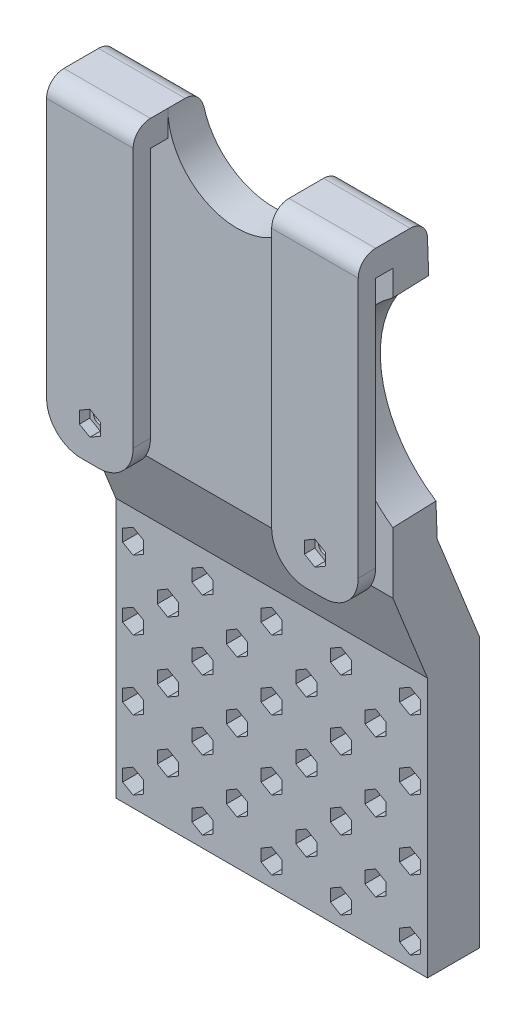
from build123d import *

# Parameters (mm, degrees)
EXTRUDE_1_DEPTH        = 45
EXTRUDE_1_DEPTH_BACK   = 45
CUT_EXTRUDE_1_REACH    = 117.109
SKETCH_2_W             = 40
SKETCH_2_H             = 90
CUT_EXTRUDE_2_DEPTH    = 113.472218792
CUT_EXTRUDE_3_REACH    = 114.571
FILLET_1_R             = 10
SKETCH_6_R             = 2
CUT_EXTRUDE_4_DEPTH    = 116.108644371
CUT_EXTRUDE_5_DEPTH    = 3
CUT_EXTRUDE_6_DEPTH    = 22
SKETCH_9_R             = 2
CUT_EXTRUDE_7_DEPTH    = 116.108644371
PATTERN_LINEAR_1_COUNT = 24
PATTERN_LINEAR_1_PITCH = 20
CUT_EXTRUDE_8_DEPTH    = 12
PATTERN_LINEAR_2_COUNT = 5
PATTERN_LINEAR_2_PITCH = 20


with BuildPart() as part:
    # 草图1 → 凸台-拉伸1 (new, two sides: drawn at the far end of the back side and taken through both)
    with BuildSketch(Plane(origin=(0, 0, 0), x_dir=(0, 0, -1), z_dir=(1, 0, 0)).offset(-EXTRUDE_1_DEPTH_BACK)):
        with BuildLine():
            Line((-2.5, 0), (-2.5, 82.5))
            Line((-2.5, 82.5), (2.5, 82.5))
            Line((2.5, 82.5), (2.5, 0))
            Line((2.5, 0), (12.5, -25))
            Line((12.5, -25), (12.5, -100))
            Line((12.5, -100), (27.5, -100))
            Line((27.5, -100), (27.5, -22.111263946))
            Line((27.5, -22.111263946), (15.30380141, 8.379232528))
            Line((15.30380141, 8.379232528), (12.5, 85.182410093))
            ThreePointArc((12.5, 85.182410093), (10.973771474, 88.599447906), (7.503328452, 90))
            Line((7.503328452, 90), (-2.5, 90))
            ThreePointArc((-2.5, 90), (-6.035533906, 88.535533906), (-7.5, 85))
            Line((-7.5, 85), (-7.5, 0))
            Line((-7.5, 0), (-2.5, 0))
        make_face()
    extrude(amount=EXTRUDE_1_DEPTH + EXTRUDE_1_DEPTH_BACK)

    # 切除-拉伸1: up to this face of the body (flat: up to its plane)
    cut_extrude_1_end = Plane(part.part.faces().sort_by_distance((0, 41.25, -2.5))[0])
    # 草图2 → 切除-拉伸1 (cut, up to the picked face)
    with BuildSketch(Plane.XY.offset(7.5), mode=Mode.PRIVATE) as cut_extrude_1_sk1:
        with Locations((0, 45)):
            Rectangle(SKETCH_2_W, SKETCH_2_H)
    cut_extrude_1_tool1 = split(extrude(cut_extrude_1_sk1.sketch, amount=-CUT_EXTRUDE_1_REACH, mode=Mode.PRIVATE), bisect_by=cut_extrude_1_end, keep=Keep.BOTH, mode=Mode.PRIVATE)
    add(cut_extrude_1_tool1.solids().sort_by(Axis((0, 45, 7.5), (0, 0, -1)))[0], mode=Mode.SUBTRACT)

    # 草图3 → 切除-拉伸2 (cut, through all)
    with BuildSketch(Plane.XY.offset(-2.5)):
        with BuildLine():
            Line((20, 90), (-20, 90))
            ThreePointArc((-20, 90), (0, 70), (20, 90))
        make_face()
    extrude(amount=-CUT_EXTRUDE_2_DEPTH, mode=Mode.SUBTRACT)

    # 切除-拉伸3: up to this plane
    cut_extrude_3_end = Plane(origin=(-45, 82.5, -2.5), z_dir=(0, 0, 1))
    # 草图4 → 切除-拉伸3 (cut, up to the surface)
    with BuildSketch(Plane(origin=(0, 0.569094139, -15.588920825), x_dir=(-1, 0, 0), z_dir=(0, 0.036482018521591525, -0.9993343095904346)), mode=Mode.PRIVATE) as cut_extrude_3_sk1:
        with BuildLine():
            Line((-45, 74.9653236), (-45, 17.519697135))
            ThreePointArc((-45, 17.519697135), (-30, 46.242510367), (-45, 74.9653236))
        make_face()
    cut_extrude_3_tool1 = split(extrude(cut_extrude_3_sk1.sketch, amount=-CUT_EXTRUDE_3_REACH, mode=Mode.PRIVATE), bisect_by=cut_extrude_3_end, keep=Keep.BOTH, mode=Mode.PRIVATE)
    add(cut_extrude_3_tool1.solids().sort_by_distance((38.874032, 46.780821, -13.901901))[0], mode=Mode.SUBTRACT)
    # 草图4 → 切除-拉伸3 (cut, up to the surface)
    with BuildSketch(Plane(origin=(0, 0.569094139, -15.588920825), x_dir=(-1, 0, 0), z_dir=(0, 0.036482018521591525, -0.9993343095904346)), mode=Mode.PRIVATE) as cut_extrude_3_sk2:
        with BuildLine():
            Line((45, 74.9653236), (45, 17.519697135))
            ThreePointArc((45, 17.519697135), (30, 46.242510367), (45, 74.9653236))
        make_face()
    cut_extrude_3_tool2 = split(extrude(cut_extrude_3_sk2.sketch, amount=-CUT_EXTRUDE_3_REACH, mode=Mode.PRIVATE), bisect_by=cut_extrude_3_end, keep=Keep.BOTH, mode=Mode.PRIVATE)
    add(cut_extrude_3_tool2.solids().sort_by_distance((-38.874032, 46.780821, -13.901901))[0], mode=Mode.SUBTRACT)

    # 圆角1
    fillet_1_edges = [part.edges().sort_by_distance(p)[0] for p in [
        (45, 0, 5),
        (-45, 0, 5),
        (-20, 0, 5),
        (20, 0, 5),
    ]]
    fillet(fillet_1_edges, radius=FILLET_1_R)

    # 草图6 → 切除-拉伸4 (cut, through all)
    with BuildSketch(Plane.XY.offset(7.5)):
        with Locations(Location((-32.5, 10, 0), (0, 0, 305.866559589))):
            Circle(SKETCH_6_R)
        with Locations(Location((32.5, 10, 0), (0, 0, 90))):
            Circle(SKETCH_6_R)
    extrude(amount=-CUT_EXTRUDE_4_DEPTH, mode=Mode.SUBTRACT)

    # 草图7 → 切除-拉伸5 (cut)
    with BuildSketch(Plane.XY.offset(7.5)):
        Polygon((-32.5, 13.5), (-35.531088913, 11.75), (-35.531088913, 8.25), (-32.5, 6.5), (-29.468911087, 8.25), (-29.468911087, 11.75), align=None)
        Polygon((29.468911087, 11.75), (32.5, 13.5), (35.531088913, 11.75), (35.531088913, 8.25), (32.5, 6.5), (29.468911087, 8.25), align=None)
    extrude(amount=-CUT_EXTRUDE_5_DEPTH, mode=Mode.SUBTRACT)

    # 草图8 → 切除-拉伸6 (cut)
    with BuildSketch(Plane(origin=(0, 0, -27.5), x_dir=(-1, 0, 0), z_dir=(0, 0, -1))):
        Polygon((32.5, 13.5), (29.468911087, 11.75), (29.468911087, 8.25), (32.5, 6.5), (35.531088913, 8.25), (35.531088913, 11.75), align=None)
        Polygon((-35.531088913, 11.75), (-32.5, 13.5), (-29.468911087, 11.75), (-29.468911087, 8.25), (-32.5, 6.5), (-35.531088913, 8.25), align=None)
    extrude(amount=-CUT_EXTRUDE_6_DEPTH, mode=Mode.SUBTRACT)

    # 草图9 → 切除-拉伸7 (cut, through all)
    with BuildSketch(Plane(origin=(0, 0, -27.5), x_dir=(-1, 0, 0), z_dir=(0, 0, -1))):
        with Locations(Location((-20, -33.267881784, 0), (0, 0, 90))):
            Circle(SKETCH_9_R)
        with Locations(Location((0, -33.267881784, 0), (0, 0, 90))):
            Circle(SKETCH_9_R)
        with Locations(Location((20, -33.267881784, 0), (0, 0, 90))):
            Circle(SKETCH_9_R)
        with Locations(Location((-10, -43.734991061, 0), (0, 0, 90))):
            Circle(SKETCH_9_R)
        with Locations(Location((10, -43.734991061, 0), (0, 0, 90))):
            Circle(SKETCH_9_R)
        with Locations(Location((-40, -33.267881784, 0), (0, 0, 90))):
            Circle(SKETCH_9_R)
        with Locations(Location((40, -33.267881784, 0), (0, 0, 90))):
            Circle(SKETCH_9_R)
        with Locations(Location((-30, -43.734991061, 0), (0, 0, 90))):
            Circle(SKETCH_9_R)
        with Locations(Location((30, -43.734991061, 0), (0, 0, 90))):
            Circle(SKETCH_9_R)
    cut_extrude_7 = extrude(amount=-CUT_EXTRUDE_7_DEPTH, mode=Mode.SUBTRACT)

    # 阵列(线性)1: 切除-拉伸7 ×24
    with Locations(*[(0, -i * PATTERN_LINEAR_1_PITCH, 0) for i in range(1, PATTERN_LINEAR_1_COUNT)]):
        add(cut_extrude_7, mode=Mode.SUBTRACT)

    # 草图10 → 切除-拉伸8 (cut)
    with BuildSketch(Plane.XY.offset(-12.5)):
        Polygon((-40, -29.767881784), (-43.031088913, -31.517881784), (-43.031088913, -35.017881784), (-40, -36.767881784), (-36.968911087, -35.017881784), (-36.968911087, -31.517881784), align=None)
        Polygon((-16.968911087, -31.517881784), (-20, -29.767881784), (-23.031088913, -31.517881784), (-23.031088913, -35.017881784), (-20, -36.767881784), (-16.968911087, -35.017881784), align=None)
        Polygon((3.031088913, -31.517881784), (0, -29.767881784), (-3.031088913, -31.517881784), (-3.031088913, -35.017881784), (0, -36.767881784), (3.031088913, -35.017881784), align=None)
        Polygon((23.031088913, -31.517881784), (20, -29.767881784), (16.968911087, -31.517881784), (16.968911087, -35.017881784), (20, -36.767881784), (23.031088913, -35.017881784), align=None)
        Polygon((43.031088913, -31.517881784), (40, -29.767881784), (36.968911087, -31.517881784), (36.968911087, -35.017881784), (40, -36.767881784), (43.031088913, -35.017881784), align=None)
        Polygon((-30, -40.234991061), (-33.031088913, -41.984991061), (-33.031088913, -45.484991061), (-30, -47.234991061), (-26.968911087, -45.484991061), (-26.968911087, -41.984991061), align=None)
        Polygon((-6.968911087, -41.984991061), (-10, -40.234991061), (-13.031088913, -41.984991061), (-13.031088913, -45.484991061), (-10, -47.234991061), (-6.968911087, -45.484991061), align=None)
        Polygon((13.031088913, -41.984991061), (10, -40.234991061), (6.968911087, -41.984991061), (6.968911087, -45.484991061), (10, -47.234991061), (13.031088913, -45.484991061), align=None)
        Polygon((33.031088913, -41.984991061), (30, -40.234991061), (26.968911087, -41.984991061), (26.968911087, -45.484991061), (30, -47.234991061), (33.031088913, -45.484991061), align=None)
    cut_extrude_8 = extrude(amount=-CUT_EXTRUDE_8_DEPTH, mode=Mode.SUBTRACT)

    # 阵列(线性)2: 切除-拉伸8 ×5
    with Locations(*[(0, -i * PATTERN_LINEAR_2_PITCH, 0) for i in range(1, PATTERN_LINEAR_2_COUNT)]):
        add(cut_extrude_8, mode=Mode.SUBTRACT)


solid = part.part
